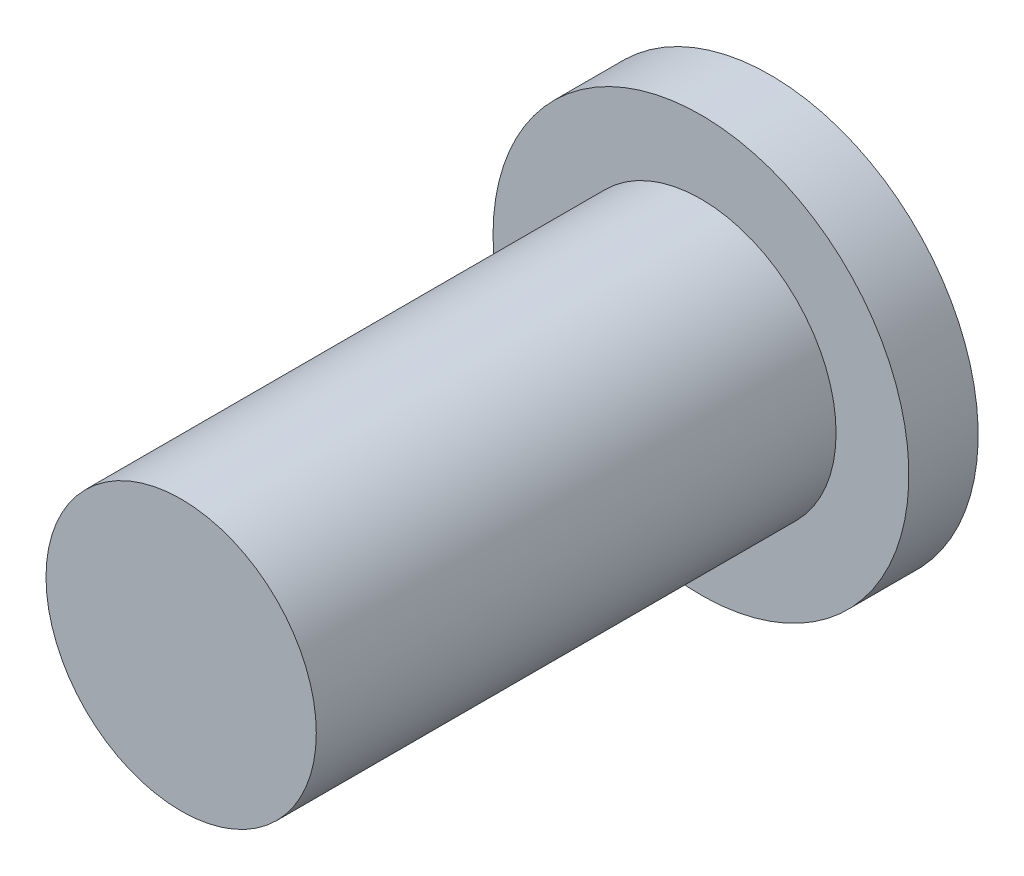
from build123d import *

# Parameters (mm, degrees)
SKETCH_1_R      = 3.9
EXTRUDE_1_DEPTH = 15
SKETCH_2_R      = 6
EXTRUDE_2_DEPTH = 2


with BuildPart() as part:
    # 草图1 → 凸台-拉伸1 (new body)
    with BuildSketch(Plane.XY):
        Circle(SKETCH_1_R)
    extrude(amount=EXTRUDE_1_DEPTH)

    # 草图2 → 凸台-拉伸2 (add)
    with BuildSketch(Plane(origin=(0, 0, 0), x_dir=(-1, 0, 0), z_dir=(0, 0, -1))):
        Circle(SKETCH_2_R)
    extrude(amount=EXTRUDE_2_DEPTH)


solid = part.part
